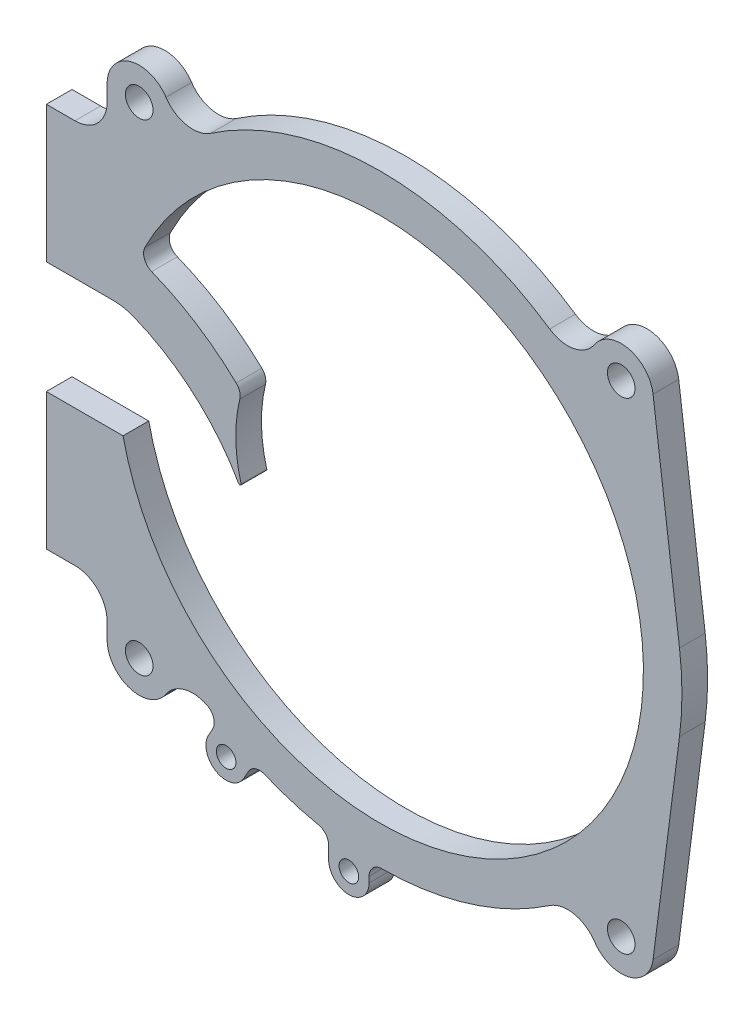
from build123d import *

# Parameters (mm, degrees)
SKETCH_1_R      = 2.15
EXTRUDE_1_DEPTH = 4
FILLET_1_R      = 0.2
FILLET_2_R      = 2
FILLET_3_R      = 2
FILLET_4_R      = 8.5
SKETCH_2_R      = 1.525
EXTRUDE_2_DEPTH = 4
FILLET_5_R      = 2


with BuildPart() as part:
    # 草图1 → 凸台-拉伸1 (new body)
    with BuildSketch(Plane.XY):
        with BuildLine():
            Line((-52, 8.75), (-52, 30))
            Line((-52, 30), (-47.54, 30))
            ThreePointArc((-47.54, 30), (-44.004466094, 31.464466094), (-42.54, 35))
            Line((-42.54, 35), (-42.54, 37.5))
            ThreePointArc((-42.54, 37.5), (-38.982425028, 42.287422066), (-33.372235985, 40.262198963))
            ThreePointArc((-33.372235985, 40.262198963), (-30.171244586, 38.118753147), (-26.396349665, 38.887436588))
            ThreePointArc((-26.396349665, 38.887436588), (0, 47), (26.396349665, 38.887436588))
            ThreePointArc((26.396349665, 38.887436588), (30.171244586, 38.118753147), (33.372235985, 40.262198963))
            ThreePointArc((33.372235985, 40.262198963), (38.674773042, 42.369526686), (42.499484755, 38.135225128))
            Line((42.499484755, 38.135225128), (46.619156699, 5.971116201))
            ThreePointArc((46.619156699, 5.971116201), (47, 0), (46.619156699, -5.971116201))
            Line((46.619156699, -5.971116201), (42.499484755, -38.135225128))
            ThreePointArc((42.499484755, -38.135225128), (38.674773042, -42.369526686), (33.372235985, -40.262198963))
            ThreePointArc((33.372235985, -40.262198963), (30.171244586, -38.118753147), (26.396349665, -38.887436588))
            ThreePointArc((26.396349665, -38.887436588), (0, -47), (-26.396349665, -38.887436588))
            ThreePointArc((-26.396349665, -38.887436588), (-30.171244586, -38.118753147), (-33.372235985, -40.262198963))
            ThreePointArc((-33.372235985, -40.262198963), (-38.982425028, -42.287422066), (-42.54, -37.5))
            Line((-42.54, -37.5), (-42.54, -35))
            ThreePointArc((-42.54, -35), (-44.004466094, -31.464466094), (-47.54, -30))
            Line((-47.54, -30), (-52, -30))
            Line((-52, -30), (-52, -8.75))
            Line((-52, -8.75), (-40.055430343, -8.75))
            ThreePointArc((-40.055430343, -8.75), (40.804364959, -4.000475011), (-37.593370285, 16.362717092))
            ThreePointArc((-37.593370285, 16.362717092), (-29.005163231, 12.290176631), (-21.585495377, 6.349518825))
            ThreePointArc((-21.585495377, 6.349518825), (-22.451945258, -1.469746278), (-20.573530425, -9.10932741))
            ThreePointArc((-20.573530425, -9.10932741), (-28.44850534, 1.855840669), (-40.055430343, 8.75))
            Line((-40.055430343, 8.75), (-52, 8.75))
        make_face()
        with Locations((-37.54, 37.5)):
            Circle(SKETCH_1_R, mode=Mode.SUBTRACT)
        with Locations((-37.54, -37.5)):
            Circle(SKETCH_1_R, mode=Mode.SUBTRACT)
        with Locations((37.54, -37.5)):
            Circle(SKETCH_1_R, mode=Mode.SUBTRACT)
        with Locations((37.54, 37.5)):
            Circle(SKETCH_1_R, mode=Mode.SUBTRACT)
    extrude(amount=EXTRUDE_1_DEPTH)

    # 圆角1
    fillet_1_edges = [part.edges().sort_by_distance(p)[0] for p in [
        (-20.573530425, -9.10932741, 2),
    ]]
    fillet(fillet_1_edges, radius=FILLET_1_R)

    # 圆角2
    fillet_2_edges = [part.edges().sort_by_distance(p)[0] for p in [
        (-21.585495377, 6.349518825, 2),
    ]]
    fillet(fillet_2_edges, radius=FILLET_2_R)

    # 圆角3
    fillet_3_edges = [part.edges().sort_by_distance(p)[0] for p in [
        (-37.593370285, 16.362717092, 2),
    ]]
    fillet(fillet_3_edges, radius=FILLET_3_R)

    # 圆角4
    fillet_4_edges = [part.edges().sort_by_distance(p)[0] for p in [
        (-40.055430343, 8.75, 2),
    ]]
    fillet(fillet_4_edges, radius=FILLET_4_R)

    # 草图2 → 凸台-拉伸2 (add)
    # profile 1 of 2: a face of its own
    with BuildSketch(Plane(origin=(0, 0, 0), x_dir=(-1, 0, 0), z_dir=(0, 0, -1))):
        with BuildLine():
            Line((1.733082495, -49.911702088), (1.733082495, -46.968036206))
            ThreePointArc((1.733082495, -46.968036206), (4.894207665, -46.744483432), (8.033082495, -46.308418086))
            Line((8.033082495, -46.308418086), (8.033082495, -49.911702088))
            ThreePointArc((8.033082495, -49.911702088), (4.883082495, -53.061702088), (1.733082495, -49.911702088))
        make_face()
        with Locations((4.883082495, -49.911702088)):
            Circle(SKETCH_2_R, mode=Mode.SUBTRACT)
    # profile 2 of 2: a face of its own
    with BuildSketch(Plane(origin=(0, 0, 0), x_dir=(-1, 0, 0), z_dir=(0, 0, -1))):
        with BuildLine():
            Line((21.234134605, -45.541810763), (19.676083646, -42.683155136))
            ThreePointArc((19.676083646, -42.683155136), (22.492522433, -41.268467801), (25.207814436, -39.668200001))
            Line((25.207814436, -39.668200001), (26.765865395, -42.526855629))
            ThreePointArc((26.765865395, -42.526855629), (25.507477567, -46.800198591), (21.234134605, -45.541810763))
        make_face()
        with Locations((24, -44.034333196)):
            Circle(SKETCH_2_R, mode=Mode.SUBTRACT)
    extrude(amount=-EXTRUDE_2_DEPTH)

    # 圆角5
    fillet_5_edges = [part.edges().sort_by_distance(p)[0] for p in [
        (-1.733082495, -46.968036206, 2),
        (-19.676083646, -42.683155136, 2),
        (-25.207814436, -39.668200001, 2),
        (-8.033082495, -46.308418086, 2),
    ]]
    fillet(fillet_5_edges, radius=FILLET_5_R)


solid = part.part
